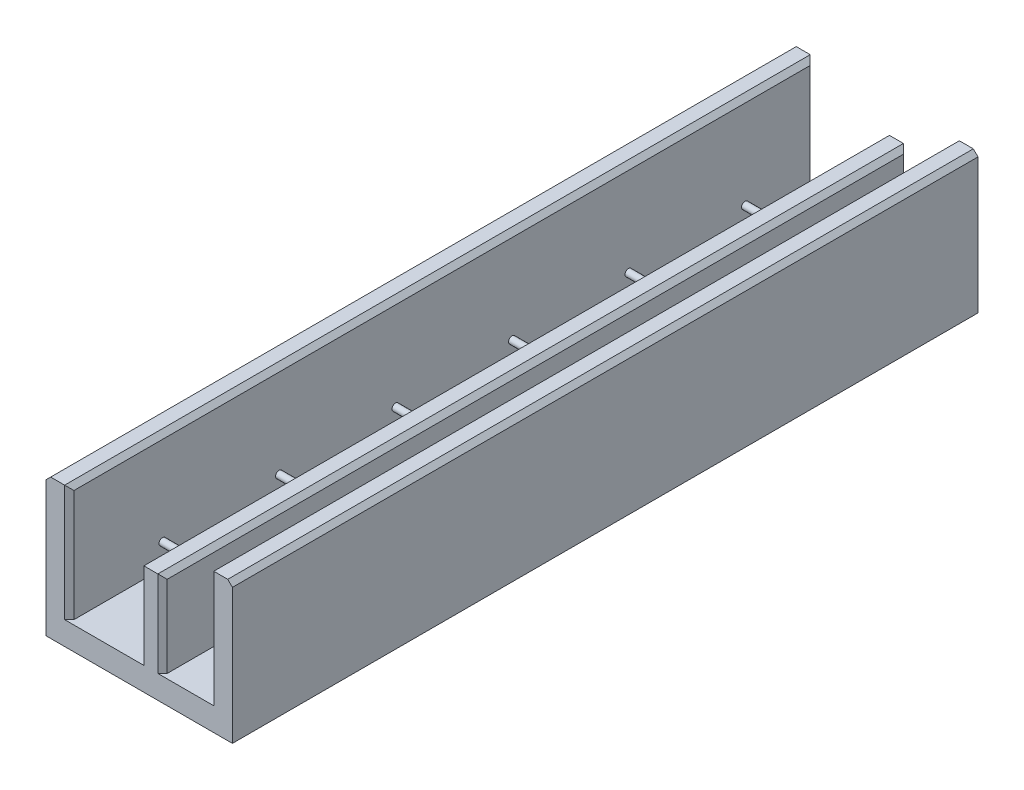
from build123d import *

# Parameters (mm, degrees)
SALIENTE_EXTRUIR1_DEPTH = 3200
CHAFL_N2_SIZE           = 20
SALIENTE_EXTRUIR2_REACH = 3354.611
CROQUIS2_R              = 15
MATRIZL1_COUNT          = 6
MATRIZL1_PITCH          = 500


with BuildPart() as part:
    # Croquis1 → Saliente-Extruir1 (new body)
    with BuildSketch(Plane.XY):
        Polygon((0, 0), (-800, 0), (-800, 600), (-700, 600), (-700, 100), (-400, 100), (-400, 470), (-300, 470), (-300, 100), (-100, 100), (-100, 600), (0, 600), align=None)
    extrude(amount=SALIENTE_EXTRUIR1_DEPTH)

    # Chaflán2
    chafl_n2_edges = [part.edges().sort_by_distance(p)[0] for p in [
        (-100, 350, 3200),
        (-700, 350, 0),
        (-400, 285, 0),
        (-300, 285, 0),
        (-100, 350, 0),
        (-300, 285, 3200),
        (-800, 600, 1600),
        (-700, 600, 1600),
        (-400, 470, 1600),
        (-300, 470, 1600),
        (-100, 600, 1600),
        (0, 600, 1600),
        (-400, 285, 3200),
        (-700, 350, 3200),
    ]]
    chamfer(chafl_n2_edges, length=CHAFL_N2_SIZE)

    # Saliente-Extruir2: up to this face of the body (flat: up to its plane)
    saliente_extruir2_end = Plane(part.part.faces().sort_by_distance((-100, 340, 1600))[0])
    # Croquis2 → Saliente-Extruir2 (add, up to the picked face)
    with BuildSketch(Plane.ZY.offset(800), mode=Mode.PRIVATE) as saliente_extruir2_sk1:
        with Locations(Location((300, 200, 0), (0, 0, 270))):
            Circle(CROQUIS2_R)
    saliente_extruir2_tool1 = split(extrude(saliente_extruir2_sk1.sketch, amount=-SALIENTE_EXTRUIR2_REACH, mode=Mode.PRIVATE), bisect_by=saliente_extruir2_end, keep=Keep.BOTH, mode=Mode.PRIVATE)
    saliente_extruir2 = saliente_extruir2_tool1.solids().sort_by(Axis((-800, 200, 300), (1, 0, 0)))[0]
    add(saliente_extruir2)

    # MatrizL1: Saliente-Extruir2 ×6
    with Locations(*[(0, 0, i * MATRIZL1_PITCH) for i in range(1, MATRIZL1_COUNT)]):
        add(saliente_extruir2)


solid = part.part
